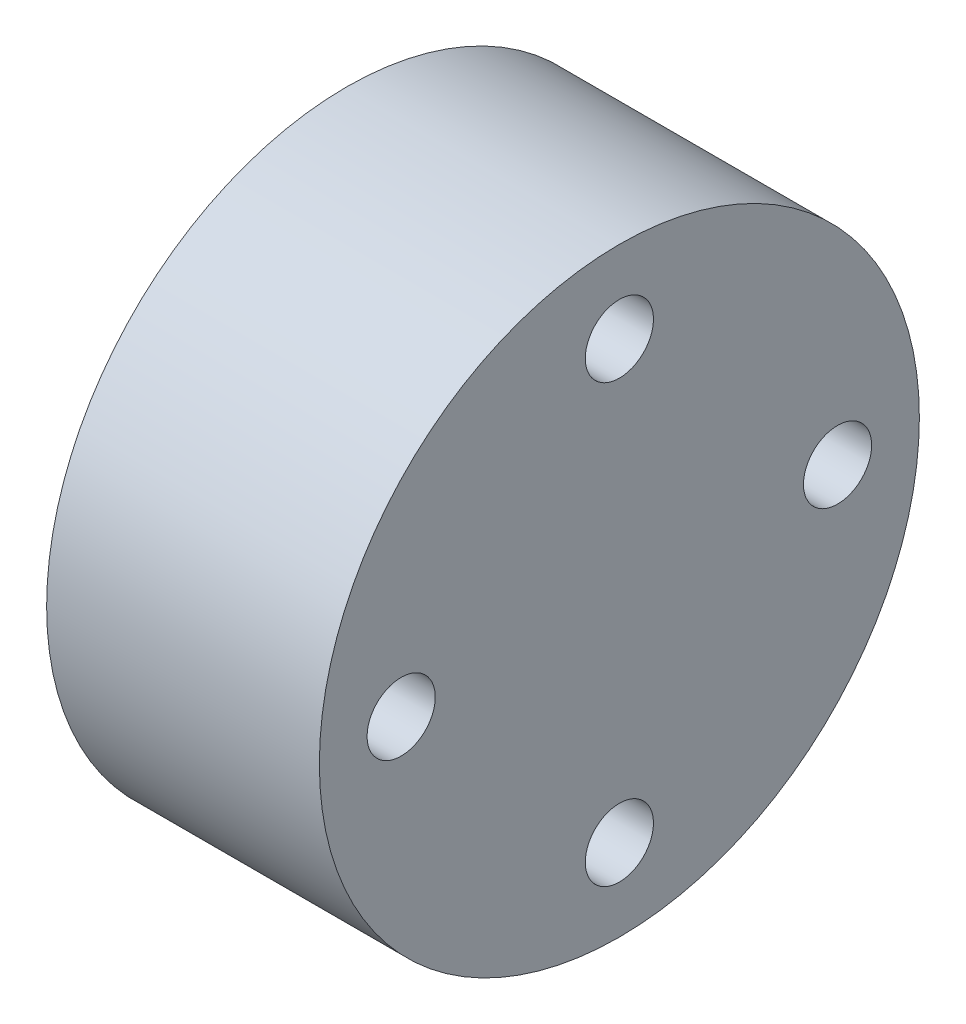
from build123d import *

# Parameters (mm, degrees)
SKETCH1_R           = 11
BOSS_EXTRUDE1_DEPTH = 10
SKETCH2_R           = 1.25
CUT_EXTRUDE1_DEPTH  = 10
SKETCH3_R           = 5
CUT_EXTRUDE2_DEPTH  = 5


with BuildPart() as part:
    # Sketch1 → Boss-Extrude1 (new body)
    with BuildSketch(Plane(origin=(0, 0, 0), x_dir=(0, 0, -1), z_dir=(1, 0, 0))):
        Circle(SKETCH1_R)
    extrude(amount=BOSS_EXTRUDE1_DEPTH)

    # Sketch2 → Cut-Extrude1 (cut)
    with BuildSketch(Plane.ZY):
        with Locations((0, 8)):
            Circle(SKETCH2_R)
        with Locations((8, 0)):
            Circle(SKETCH2_R)
        with Locations((0, -8)):
            Circle(SKETCH2_R)
        with Locations((-8, 0)):
            Circle(SKETCH2_R)
    extrude(amount=-CUT_EXTRUDE1_DEPTH, mode=Mode.SUBTRACT)

    # Sketch3 → Cut-Extrude2 (cut)
    with BuildSketch(Plane.ZY):
        Circle(SKETCH3_R)
    extrude(amount=-CUT_EXTRUDE2_DEPTH, mode=Mode.SUBTRACT)


solid = part.part
